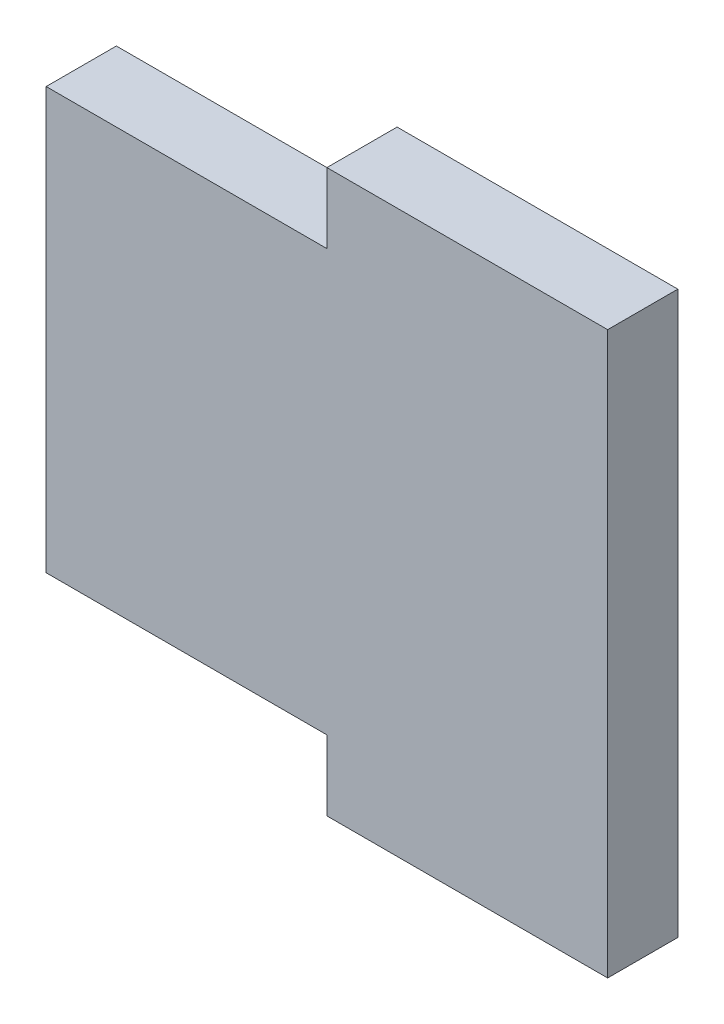
from build123d import *

# Parameters (mm, degrees)
BOSS_EXTRUDE1_DEPTH = 3.175


with BuildPart() as part:
    # Sketch1 → Boss-Extrude1 (new body)
    with BuildSketch(Plane.XY):
        Polygon((250.600505146, 0), (237.900505146, 0), (237.900505146, -3.175), (225.200505146, -3.175), (225.200505146, -22.225), (237.900505146, -22.225), (237.900505146, -25.4), (250.600505146, -25.4), align=None)
    extrude(amount=BOSS_EXTRUDE1_DEPTH)


solid = part.part
